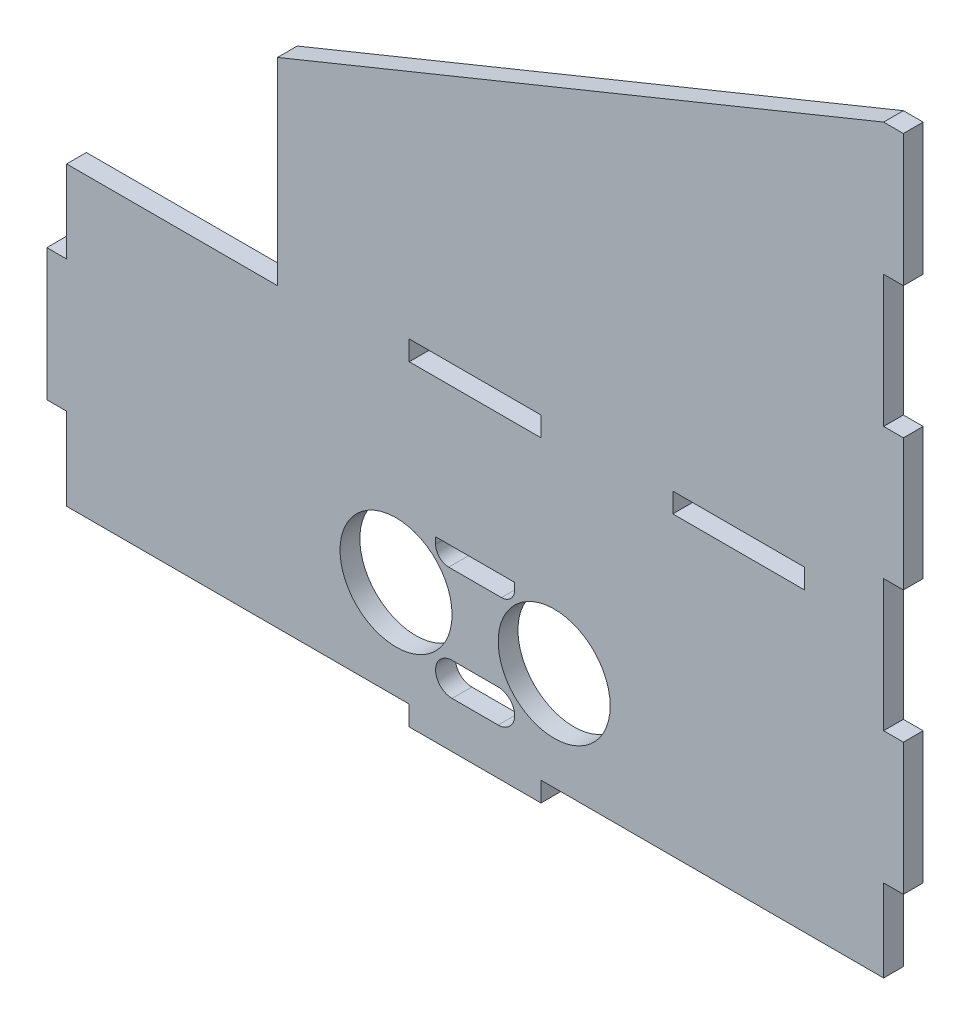
from build123d import *

# Parameters (mm, degrees)
SKETCH4_R           = 8.5
SKETCH4_W           = 20
SKETCH4_H           = 3
BOSS_EXTRUDE2_DEPTH = 3


with BuildPart() as part:
    # Sketch4 → Boss-Extrude2 (new body)
    with BuildSketch(Plane.XY):
        Polygon((62, 90), (-30, 52.5), (-30, 22.5), (-62, 22.5), (-62, 10), (-65, 10), (-65, -10), (-62, -10), (-62, -22.5), (-10, -22.5), (-10, -25.5), (10, -25.5), (10, -22.5), (62, -22.5), (62, -10), (65, -10), (65, 10), (62, 10), (62, 22.5), (62, 30), (65, 30), (65, 50), (62, 50), (62, 70), (65, 70), (65, 90), align=None)
        with Locations((-12, -7.5)):
            Circle(SKETCH4_R, mode=Mode.SUBTRACT)
        with Locations((12, -7.5)):
            Circle(SKETCH4_R, mode=Mode.SUBTRACT)
        with BuildLine():
            Line((-3.5, -13.5), (3.5, -13.5))
            ThreePointArc((3.5, -13.5), (6, -16), (3.5, -18.5))
            Line((3.5, -18.5), (-3.5, -18.5))
            ThreePointArc((-3.5, -18.5), (-6, -16), (-3.5, -13.5))
        make_face(mode=Mode.SUBTRACT)
        with BuildLine():
            Line((4, -1.5), (-4, -1.5))
            ThreePointArc((-4, -1.5), (-5.414213562, -0.914213562), (-6, 0.5))
            Line((-6, 0.5), (-6, 1.5))
            Line((-6, 1.5), (6, 1.5))
            Line((6, 1.5), (6, 0.5))
            ThreePointArc((6, 0.5), (5.414213562, -0.914213562), (4, -1.5))
        make_face(mode=Mode.SUBTRACT)
        with Locations((0, 24)):
            Rectangle(SKETCH4_W, SKETCH4_H, mode=Mode.SUBTRACT)
        with Locations((40, 24)):
            Rectangle(SKETCH4_W, SKETCH4_H, mode=Mode.SUBTRACT)
    extrude(amount=BOSS_EXTRUDE2_DEPTH)


solid = part.part
